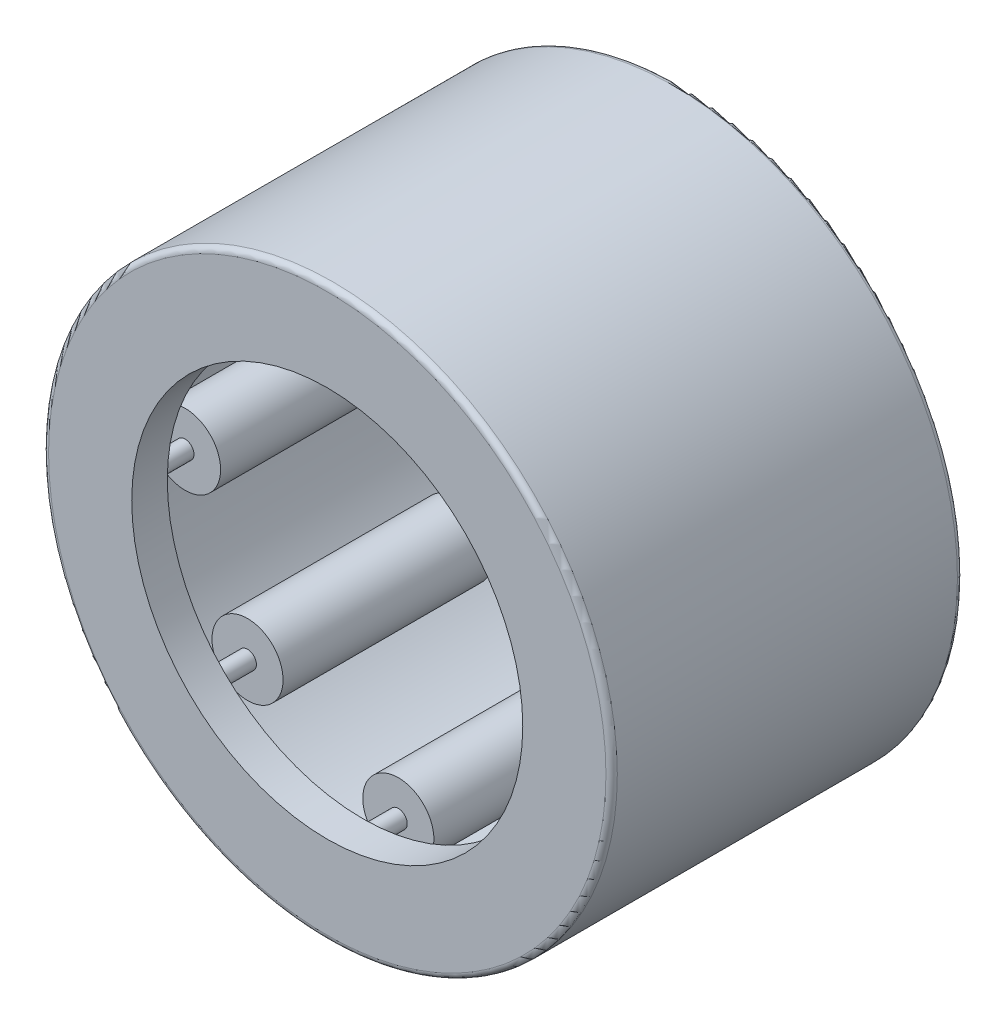
from build123d import *

# Parameters (mm, degrees)
SKETCH2_W         = 4.6736
SKETCH2_H         = 0.5953125
SKETCH3_W         = 6.2611
SKETCH3_H         = 0.1984375
CIRPATTERN1_COUNT = 8
CIRPATTERN1_ANGLE = 315
FILLET1_R         = 0.127


with BuildPart() as part:
    # Sketch1 → Revolve1 (revolve)
    with BuildSketch(Plane(origin=(0, 0, 0), x_dir=(0, 0, -1), z_dir=(1, 0, 0))):
        Polygon((-3.9243, 6.35), (3.9243, 6.35), (3.9243, 4.365625), (3.13055, 4.365625), (3.13055, 5.55625), (-3.13055, 5.55625), (-3.13055, 4.365625), (-3.9243, 4.365625), align=None)
    revolve(axis=Axis((0, 0, 3.9243), (0, 0, -1)))

    # Fillet1
    fillet1_edges = [part.edges().sort_by_distance(p)[0] for p in [
        (0, -6.35, -3.9243),
        (0, -6.35, 3.9243),
    ]]
    fillet(fillet1_edges, radius=FILLET1_R)


with BuildPart() as body_2:
    # Sketch2 → Revolve2 (revolve)
    with BuildSketch(Plane(origin=(0, 0, 0), x_dir=(0, 0, -1), z_dir=(1, 0, 0))):
        with Locations((0, 5.25859375)):
            Rectangle(SKETCH2_W, SKETCH2_H)
    revolve(axis=Axis((0, 4.7625, 2.3368), (0, 0, -1)))


with BuildPart() as body_3:
    # Sketch3 → Revolve3 (revolve)
    with BuildSketch(Plane(origin=(0, 0, 0), x_dir=(0, 0, -1), z_dir=(1, 0, 0))):
        with Locations((0, 4.86171875)):
            Rectangle(SKETCH3_W, SKETCH3_H)
    revolve(axis=Axis((0, 4.7625, 3.13055), (0, 0, -1)))


with BuildPart() as cirpattern1_1:
    # CirPattern1: pattern copy
    add(body_2.part.rotate(Axis((0, 0, -3.9243), (0, 0, 1)), 1 * CIRPATTERN1_ANGLE / (CIRPATTERN1_COUNT - 1)))


with BuildPart() as cirpattern1_2:
    # CirPattern1: pattern copy
    add(body_2.part.rotate(Axis((0, 0, -3.9243), (0, 0, 1)), 2 * CIRPATTERN1_ANGLE / (CIRPATTERN1_COUNT - 1)))


with BuildPart() as cirpattern1_3:
    # CirPattern1: pattern copy
    add(body_2.part.rotate(Axis((0, 0, -3.9243), (0, 0, 1)), 3 * CIRPATTERN1_ANGLE / (CIRPATTERN1_COUNT - 1)))


with BuildPart() as cirpattern1_4:
    # CirPattern1: pattern copy
    add(body_2.part.rotate(Axis((0, 0, -3.9243), (0, 0, 1)), 4 * CIRPATTERN1_ANGLE / (CIRPATTERN1_COUNT - 1)))


with BuildPart() as cirpattern1_5:
    # CirPattern1: pattern copy
    add(body_2.part.rotate(Axis((0, 0, -3.9243), (0, 0, 1)), 5 * CIRPATTERN1_ANGLE / (CIRPATTERN1_COUNT - 1)))


with BuildPart() as cirpattern1_6:
    # CirPattern1: pattern copy
    add(body_2.part.rotate(Axis((0, 0, -3.9243), (0, 0, 1)), 6 * CIRPATTERN1_ANGLE / (CIRPATTERN1_COUNT - 1)))


with BuildPart() as cirpattern1_7:
    # CirPattern1: pattern copy
    add(body_2.part.rotate(Axis((0, 0, -3.9243), (0, 0, 1)), 7 * CIRPATTERN1_ANGLE / (CIRPATTERN1_COUNT - 1)))


with BuildPart() as cirpattern1_8:
    # CirPattern1: pattern copy
    add(body_3.part.rotate(Axis((0, 0, -3.9243), (0, 0, 1)), 1 * CIRPATTERN1_ANGLE / (CIRPATTERN1_COUNT - 1)))


with BuildPart() as cirpattern1_9:
    # CirPattern1: pattern copy
    add(body_3.part.rotate(Axis((0, 0, -3.9243), (0, 0, 1)), 2 * CIRPATTERN1_ANGLE / (CIRPATTERN1_COUNT - 1)))


with BuildPart() as cirpattern1_10:
    # CirPattern1: pattern copy
    add(body_3.part.rotate(Axis((0, 0, -3.9243), (0, 0, 1)), 3 * CIRPATTERN1_ANGLE / (CIRPATTERN1_COUNT - 1)))


with BuildPart() as cirpattern1_11:
    # CirPattern1: pattern copy
    add(body_3.part.rotate(Axis((0, 0, -3.9243), (0, 0, 1)), 4 * CIRPATTERN1_ANGLE / (CIRPATTERN1_COUNT - 1)))


with BuildPart() as cirpattern1_12:
    # CirPattern1: pattern copy
    add(body_3.part.rotate(Axis((0, 0, -3.9243), (0, 0, 1)), 5 * CIRPATTERN1_ANGLE / (CIRPATTERN1_COUNT - 1)))


with BuildPart() as cirpattern1_13:
    # CirPattern1: pattern copy
    add(body_3.part.rotate(Axis((0, 0, -3.9243), (0, 0, 1)), 6 * CIRPATTERN1_ANGLE / (CIRPATTERN1_COUNT - 1)))


with BuildPart() as cirpattern1_14:
    # CirPattern1: pattern copy
    add(body_3.part.rotate(Axis((0, 0, -3.9243), (0, 0, 1)), 7 * CIRPATTERN1_ANGLE / (CIRPATTERN1_COUNT - 1)))


solid = Compound([part.part, body_2.part, body_3.part, cirpattern1_1.part, cirpattern1_2.part, cirpattern1_3.part, cirpattern1_4.part, cirpattern1_5.part, cirpattern1_6.part, cirpattern1_7.part, cirpattern1_8.part, cirpattern1_9.part, cirpattern1_10.part, cirpattern1_11.part, cirpattern1_12.part, cirpattern1_13.part, cirpattern1_14.part])
